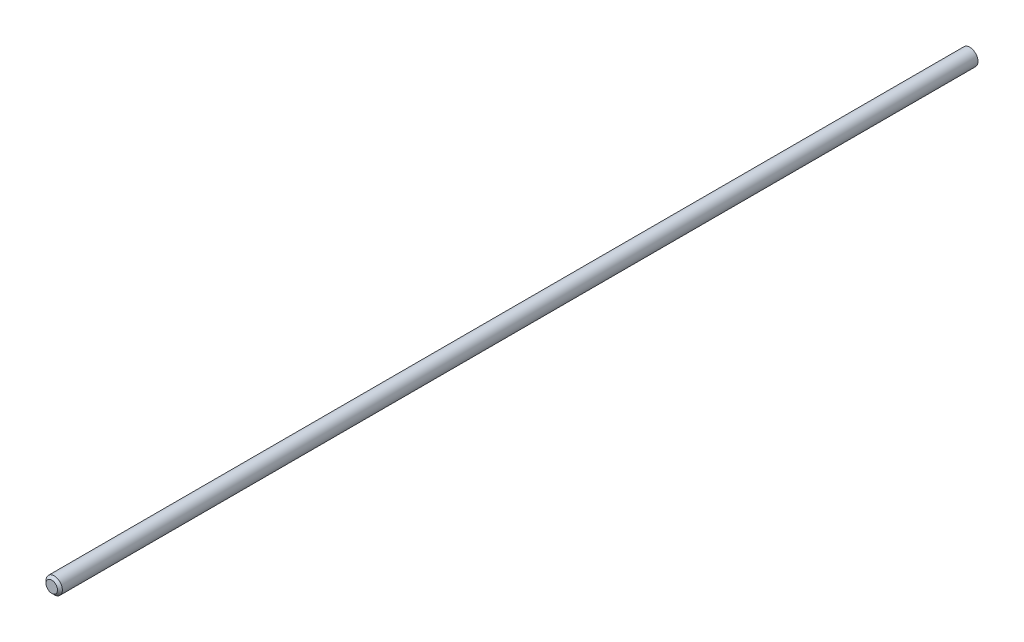
from build123d import *

# Parameters (mm, degrees)
SKETCH2_W               = 609.6
SKETCH2_H               = 3.175
CHAMFER1_SIZE           = 0.9525
CUT_EXTRUDE1_DEPTH      = 305.833071123
CUT_EXTRUDE1_DEPTH_BACK = 305.833071123
SKETCH5_W               = 254
SKETCH5_H               = 50.8


with BuildPart() as part:
    # Sketch2 → Revolve1 (revolve)
    with BuildSketch(Plane(origin=(0, 0, 0), x_dir=(0, 0, -1), z_dir=(1, 0, 0))):
        with Locations((0, 1.5875)):
            Rectangle(SKETCH2_W, SKETCH2_H)
    revolve(axis=Axis((0, 0, 304.8), (0, 0, -1)))

    # Chamfer1
    chamfer1_edges = [part.edges().sort_by_distance(p)[0] for p in [
        (0, -3.175, -304.8),
        (0, -3.175, 304.8),
    ]]
    chamfer(chamfer1_edges, length=CHAMFER1_SIZE)

    # Sketch5 → Cut-Extrude1 (cut, two sides: drawn at the far end of the back side and taken through both)
    with BuildSketch(Plane(origin=(0, 0, 0), x_dir=(0, 0, -1), z_dir=(1, 0, 0)).offset(-CUT_EXTRUDE1_DEPTH_BACK)):
        with Locations((177.8, 0)):
            Rectangle(SKETCH5_W, SKETCH5_H)
    extrude(amount=CUT_EXTRUDE1_DEPTH + CUT_EXTRUDE1_DEPTH_BACK, mode=Mode.SUBTRACT)


solid = part.part
